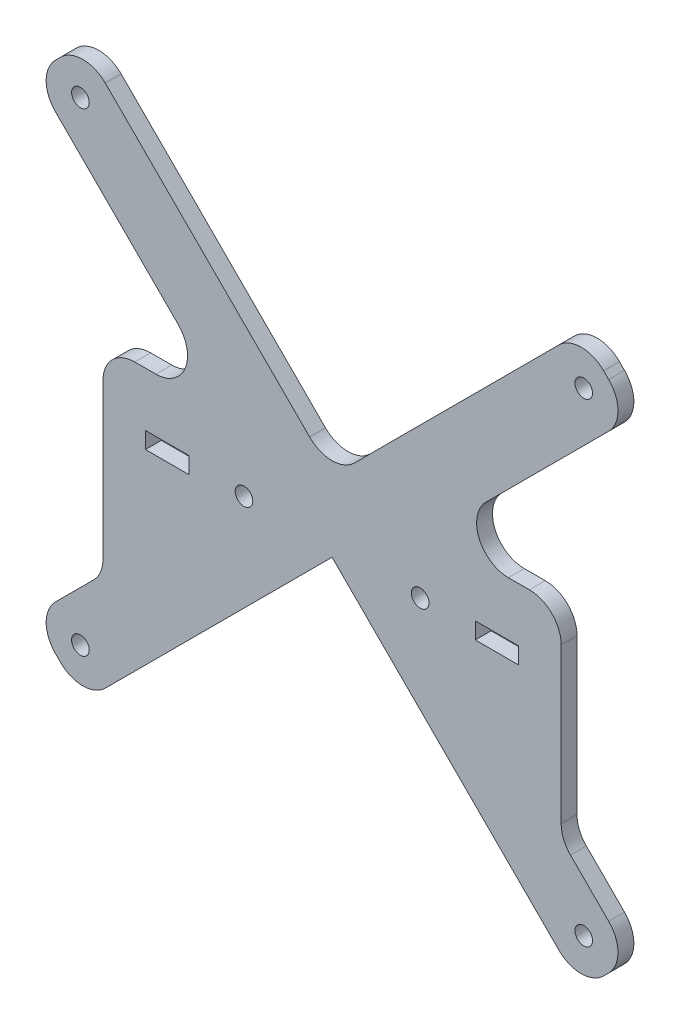
from build123d import *

# Parameters (mm, degrees)
BOSS_EXTRUDE1_DEPTH     = 4.5
SKETCH3_R               = 2.5
CUT_EXTRUDE3_DEPTH      = 118.194127679
FILLET1_R               = 9
FILLET2_R               = 9
SKETCH5_R               = 2.5
CUT_EXTRUDE4_DEPTH      = 112.927846314
MIRROR2_COPY_1_SKETCH_R = 2.5
MIRROR2_COPY_1_DEPTH    = 112.927846314


with BuildPart() as part:
    # Sketch1 → Boss-Extrude1 (new body)
    with BuildSketch(Plane.XY):
        Polygon((-28.284271247, -10), (-6.15, -10), (-6.15, -5.3), (6.15, -5.3), (6.15, -10), (28.284271247, -10), (40.65, -10), (40.65, -5.3), (52.95, -5.3), (52.95, -10), (65, -10), (65, 10), (28.284271247, 10), (0, 10), (-28.284271247, 10), (-65, 10), (-65, -10), (-52.95, -10), (-52.95, -5.3), (-40.65, -5.3), (-40.65, -10), align=None)
        Polygon((-70.710678119, -80.710678119), (0, -10), (-6.15, -10), (-28.284271247, -10), (-65, -46.715728753), (-84.852813742, -66.568542495), align=None)
        Polygon((6.15, -10), (0, -10), (70.710678119, -80.710678119), (84.852813742, -66.568542495), (65, -46.715728753), (28.284271247, -10), align=None)
        Polygon((0, 10), (28.284271247, 10), (84.852813742, 66.568542495), (70.710678119, 80.710678119), align=None)
        Polygon((-84.852813742, 66.568542495), (-28.284271247, 10), (0, 10), (-70.710678119, 80.710678119), align=None)
        Polygon((-6.15, -10), (0, -10), (6.15, -10), (6.15, -5.3), (-6.15, -5.3), align=None)
        Polygon((-65, -46.715728753), (-28.284271247, -10), (-40.65, -10), (-52.95, -10), (-65, -10), align=None)
        Polygon((40.65, -10), (28.284271247, -10), (65, -46.715728753), (65, -10), (52.95, -10), align=None)
    extrude(amount=BOSS_EXTRUDE1_DEPTH)

    # Sketch3 → Cut-Extrude3 (cut, through all)
    with BuildSketch(Plane.XY.offset(4.5)):
        with Locations((-25, -7.5)):
            Circle(SKETCH3_R)
        with Locations((25, -7.5)):
            Circle(SKETCH3_R)
    extrude(amount=-CUT_EXTRUDE3_DEPTH, mode=Mode.SUBTRACT)

    # Fillet1
    fillet1_edges = [part.edges().sort_by_distance(p)[0] for p in [
        (-65, -46.715728753, 2.25),
        (-65, 10, 2.25),
        (-28.284271247, 10, 2.25),
        (0, 10, 2.25),
        (28.284271247, 10, 2.25),
        (65, 10, 2.25),
        (65, -46.715728753, 2.25),
    ]]
    fillet(fillet1_edges, radius=FILLET1_R)

    # Fillet2
    fillet2_edges = [part.edges().sort_by_distance(p)[0] for p in [
        (-70.710678119, -80.710678119, 2.25),
        (-84.852813742, -66.568542495, 2.25),
        (-84.852813742, 66.568542495, 2.25),
        (-70.710678119, 80.710678119, 2.25),
        (70.710678119, 80.710678119, 2.25),
        (84.852813742, 66.568542495, 2.25),
        (84.852813742, -66.568542495, 2.25),
        (70.710678119, -80.710678119, 2.25),
    ]]
    fillet(fillet2_edges, radius=FILLET2_R)

    # Sketch5 → Cut-Extrude4 (cut, through all)
    with BuildSketch(Plane.XY.offset(4.5)):
        with Locations((-71.4177849, 67.275649276)):
            Circle(SKETCH5_R)
    cut_extrude4 = extrude(amount=-CUT_EXTRUDE4_DEPTH, mode=Mode.SUBTRACT)

    # Mirror1: Cut-Extrude4 across plane
    add(cut_extrude4.mirror(Plane(origin=(0, 0, 0), x_dir=(0, 0, 1), z_dir=(1, 0, 0))), mode=Mode.SUBTRACT)

    # Mirror2: Cut-Extrude4 across plane
    add(cut_extrude4.mirror(Plane.ZX), mode=Mode.SUBTRACT)

    # Mirror2 copy 1 sketch → Mirror2 copy 1 (cut, through all)
    with BuildSketch(Plane(origin=(0, 0, 4.5), x_dir=(-1, 0, 0), z_dir=(0, 0, 1))):
        with Locations((-71.4177849, 67.275649276)):
            Circle(MIRROR2_COPY_1_SKETCH_R)
    extrude(amount=-MIRROR2_COPY_1_DEPTH, mode=Mode.SUBTRACT)


solid = part.part
